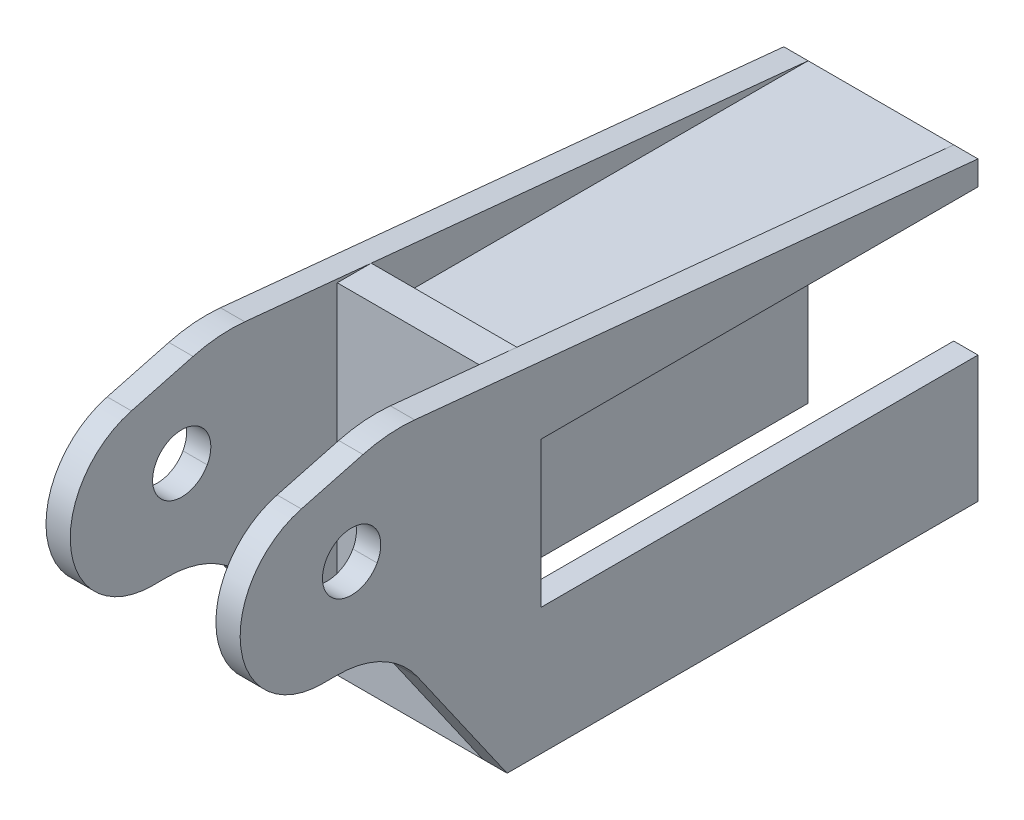
from build123d import *

# Parameters (mm, degrees)
SZKIC1_W                    = 30
SZKIC1_H                    = 70
DODANIE_WYCI_GNI_CIE1_DEPTH = 7
DODANIE_WYCI_GNI_CIE2_DEPTH = 5
ZAOKR_GLENIE1_R             = 16.956486
ZAOKR_GLENIE2_R             = 16.956486
ZAOKR_GLENIE3_R             = 30
ZAOKR_GLENIE4_R             = 30
ZAOKR_GLENIE5_R             = 20
ZAOKR_GLENIE6_R             = 20
SZKIC6_R                    = 6
WYTNIJ_WYCI_GNI_CIE2_DEPTH  = 106.464214961
SZKIC9_W                    = 5
SZKIC9_H                    = 26.11
DODANIE_WYCI_GNI_CIE3_DEPTH = 90
SZKIC13_W                   = 30
SZKIC13_H                   = 90
DODANIE_WYCI_GNI_CIE6_DEPTH = 5


with BuildPart() as part:
    # Szkic1 → Dodanie-wyciągnięcie1 (new body)
    with BuildSketch(Plane.XY):
        Rectangle(SZKIC1_W, SZKIC1_H)
    extrude(amount=DODANIE_WYCI_GNI_CIE1_DEPTH)

    # Szkic5 → Dodanie-wyciągnięcie2 (add)
    with BuildSketch(Plane.ZY.offset(15)):
        Polygon((7, -35), (31.452159225, 0), (62, 0), (62, 30), (31.452159225, 38.106774395), (0, 35), (-90, 26.11), (-90, 21.11), (0, 21.11), (0, -35), align=None)
    dodanie_wyci_gni_cie2 = extrude(amount=DODANIE_WYCI_GNI_CIE2_DEPTH)

    # Lustro1: Dodanie-wyciągnięcie2 across plane
    add(dodanie_wyci_gni_cie2.mirror(Plane(origin=(0, 0, 0), x_dir=(0, 0, 1), z_dir=(1, 0, 0))))

    # Zaokrąglenie1
    zaokr_glenie1_edges = [part.edges().sort_by_distance(p)[0] for p in [
        (-17.5, 0, 62),
        (-17.5, 30, 62),
    ]]
    fillet(zaokr_glenie1_edges, radius=ZAOKR_GLENIE1_R)

    # Zaokrąglenie2
    zaokr_glenie2_edges = [part.edges().sort_by_distance(p)[0] for p in [
        (17.5, 30, 62),
        (17.5, 0, 62),
    ]]
    fillet(zaokr_glenie2_edges, radius=ZAOKR_GLENIE2_R)

    # Zaokrąglenie3
    zaokr_glenie3_edges = [part.edges().sort_by_distance(p)[0] for p in [
        (-17.5, 38.106774395, 31.452159225),
    ]]
    fillet(zaokr_glenie3_edges, radius=ZAOKR_GLENIE3_R)

    # Zaokrąglenie4
    zaokr_glenie4_edges = [part.edges().sort_by_distance(p)[0] for p in [
        (17.5, 38.106774395, 31.452159225),
    ]]
    fillet(zaokr_glenie4_edges, radius=ZAOKR_GLENIE4_R)

    # Zaokrąglenie5
    zaokr_glenie5_edges = [part.edges().sort_by_distance(p)[0] for p in [
        (-17.5, 0, 31.452159225),
    ]]
    fillet(zaokr_glenie5_edges, radius=ZAOKR_GLENIE5_R)

    # Zaokrąglenie6
    zaokr_glenie6_edges = [part.edges().sort_by_distance(p)[0] for p in [
        (17.5, 0, 31.452159225),
    ]]
    fillet(zaokr_glenie6_edges, radius=ZAOKR_GLENIE6_R)

    # Szkic6 → Wytnij-wyciągnięcie2 (cut, through all)
    with BuildSketch(Plane.ZY.offset(20)):
        with Locations((39.04, 18.8)):
            Circle(SZKIC6_R)
    extrude(amount=-WYTNIJ_WYCI_GNI_CIE2_DEPTH, mode=Mode.SUBTRACT)

    # Szkic9 → Dodanie-wyciągnięcie3 (add)
    with BuildSketch(Plane(origin=(0, 0, 0), x_dir=(-1, 0, 0), z_dir=(0, 0, -1))):
        with Locations((-17.5, -21.945)):
            Rectangle(SZKIC9_W, SZKIC9_H)
        with Locations((17.5, -21.945)):
            Rectangle(SZKIC9_W, SZKIC9_H)
    extrude(amount=DODANIE_WYCI_GNI_CIE3_DEPTH)

    # Szkic13 → Dodanie-wyciągnięcie6 (add)
    with BuildSketch(Plane.XZ.offset(-21.11)):
        with Locations((0, -45)):
            Rectangle(SZKIC13_W, SZKIC13_H)
    extrude(amount=-DODANIE_WYCI_GNI_CIE6_DEPTH)


solid = part.part
